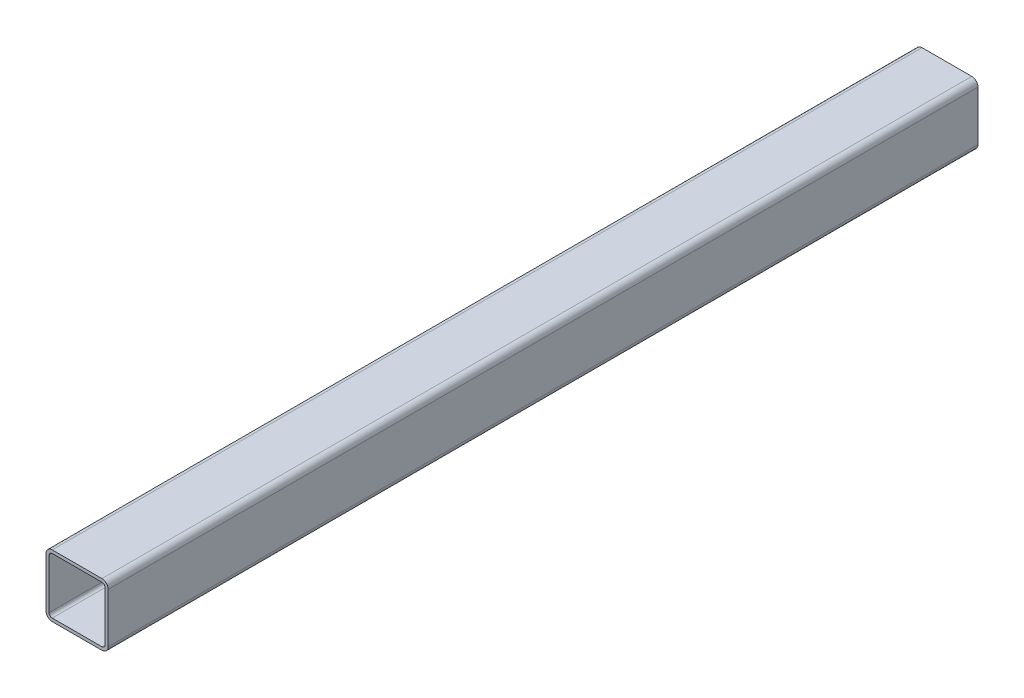
from build123d import *

# Parameters (mm, degrees)
Y_KSEKLIK_EKSTR_ZYON1_DEPTH = 560


with BuildPart() as part:
    # Çizim1 → Yükseklik-Ekstrüzyon1 (new body)
    with BuildSketch(Plane.XY):
        with BuildLine():
            Line((-16, 20), (16, 20))
            ThreePointArc((16, 20), (18.828427125, 18.828427125), (20, 16))
            Line((20, 16), (20, -16))
            ThreePointArc((20, -16), (18.828427125, -18.828427125), (16, -20))
            Line((16, -20), (-16, -20))
            ThreePointArc((-16, -20), (-18.828427125, -18.828427125), (-20, -16))
            Line((-20, -16), (-20, 16))
            ThreePointArc((-20, 16), (-18.828427125, 18.828427125), (-16, 20))
        make_face()
        with BuildLine():
            Line((-18, 16), (-18, -16))
            ThreePointArc((-18, -16), (-17.414213562, -17.414213562), (-16, -18))
            Line((-16, -18), (16, -18))
            ThreePointArc((16, -18), (17.414213562, -17.414213562), (18, -16))
            Line((18, -16), (18, 16))
            ThreePointArc((18, 16), (17.414213562, 17.414213562), (16, 18))
            Line((16, 18), (-16, 18))
            ThreePointArc((-16, 18), (-17.414213562, 17.414213562), (-18, 16))
        make_face(mode=Mode.SUBTRACT)
    extrude(amount=Y_KSEKLIK_EKSTR_ZYON1_DEPTH)


solid = part.part
